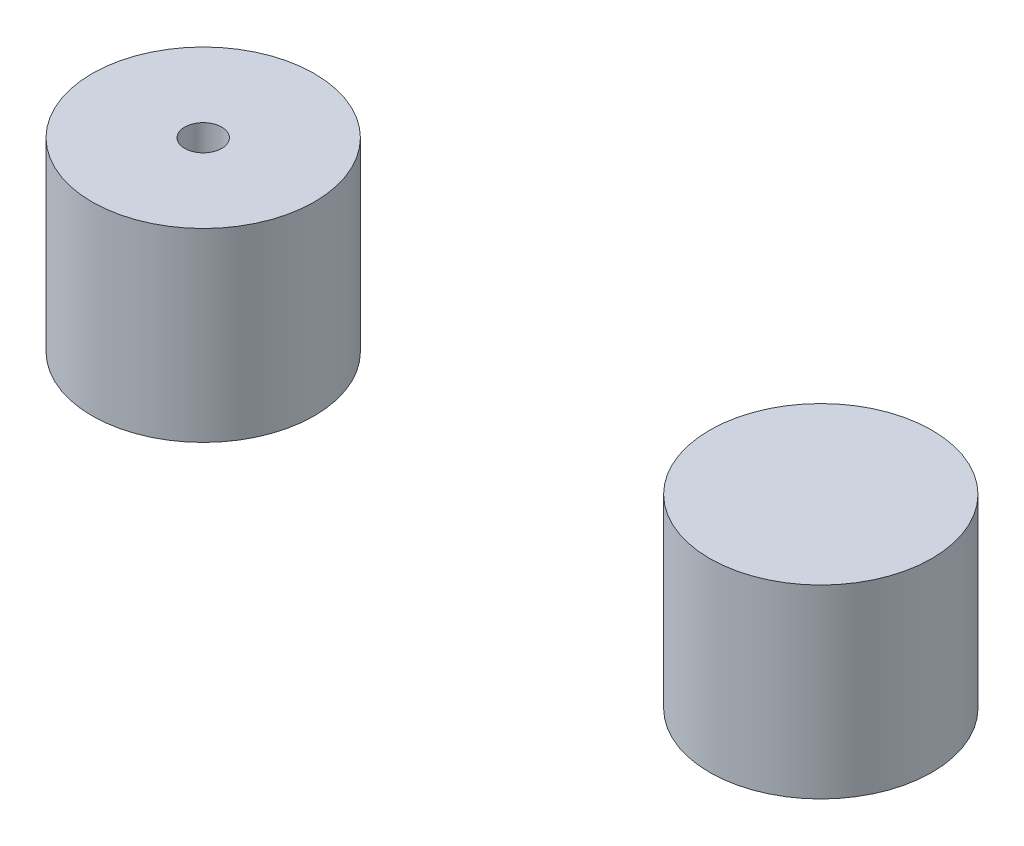
from build123d import *

# Parameters (mm, degrees)
SKETCH1_R             = 1.8
SKETCH1_R_2           = 0.3
BOSS_EXTRUDE1_DEPTH   = 3
BOSS_EXTRUDE1_2_DEPTH = 3


with BuildPart() as part:
    # Sketch1 → Boss-Extrude1 (new body)
    with BuildSketch(Plane(origin=(0, 0, 0), x_dir=(1, 0, 0), z_dir=(0, 1, 0))):
        with Locations(Location((0, 0, 0), (0, 0, 270))):
            Circle(SKETCH1_R)
        with Locations(Location((0, 0, 0), (0, 0, 270))):
            Circle(SKETCH1_R_2, mode=Mode.SUBTRACT)
    extrude(amount=BOSS_EXTRUDE1_DEPTH)


with BuildPart() as body_2:
    # Sketch1 → Boss-Extrude1 2 (new body)
    with BuildSketch(Plane(origin=(0, 0, 0), x_dir=(1, 0, 0), z_dir=(0, 1, 0))):
        with Locations(Location((10, 0, 0), (0, 0, 270))):
            Circle(SKETCH1_R)
    extrude(amount=BOSS_EXTRUDE1_2_DEPTH)


solid = Compound([part.part, body_2.part])
